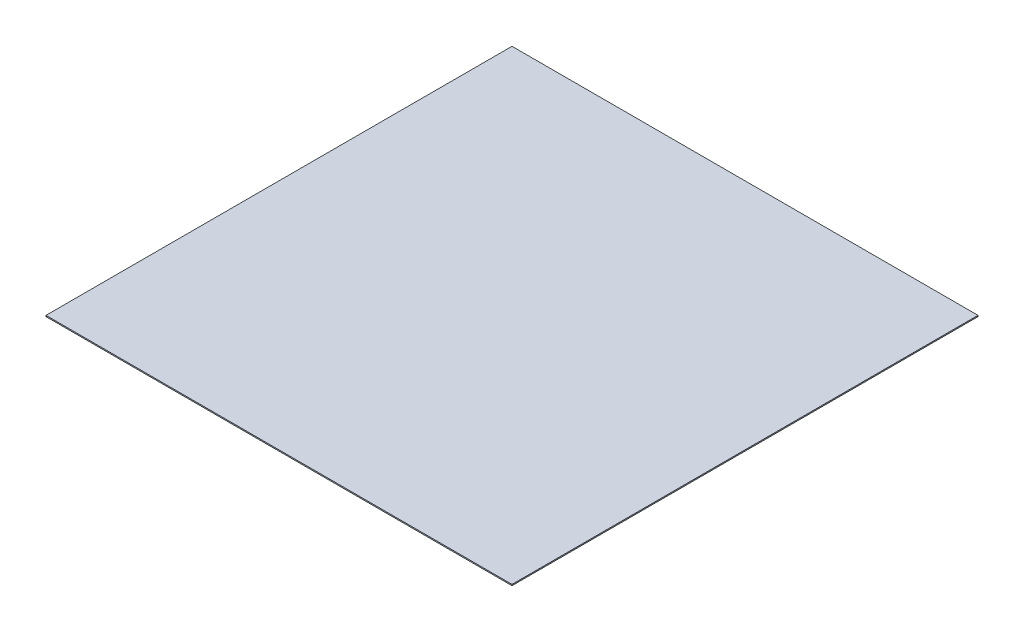
from build123d import *

# Parameters (mm, degrees)
SKETCH1_W           = 400
SKETCH1_H           = 400
BOSS_EXTRUDE1_DEPTH = 1


with BuildPart() as part:
    # Sketch1 → Boss-Extrude1 (new body)
    with BuildSketch(Plane(origin=(0, 0, 0), x_dir=(1, 0, 0), z_dir=(0, 1, 0))):
        with Locations((200, -200)):
            Rectangle(SKETCH1_W, SKETCH1_H)
    extrude(amount=BOSS_EXTRUDE1_DEPTH)


solid = part.part
